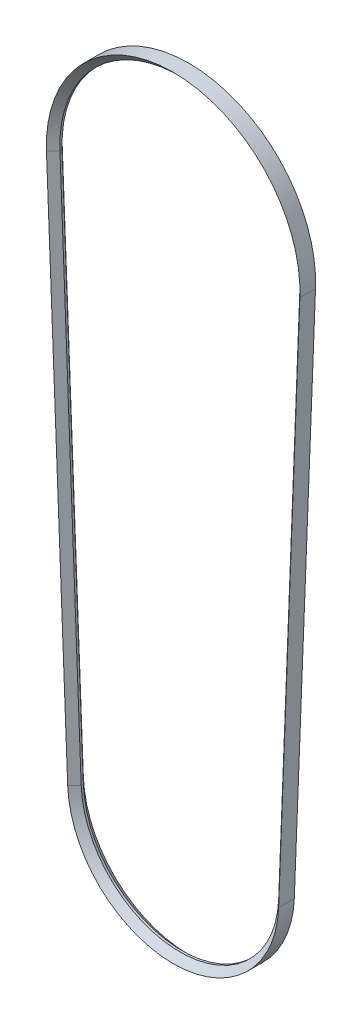
from build123d import *


with BuildPart() as part:
    # Sweep1: sweep along a path in Sketch1
    with BuildLine(Plane.XY) as sweep1_path:
        Line((139.891457706, 629.488188976), (114.910840259, -4.527559055))
        ThreePointArc((114.910840259, -4.527559055), (0, -115), (-114.910840259, -4.527559055))
        Line((-114.910840259, -4.527559055), (-139.891457706, 629.488188976))
        ThreePointArc((-139.891457706, 629.488188976), (0, 775), (139.891457706, 629.488188976))
    # Sketch2 → Sweep1 (sweep)
    with BuildSketch(Plane(origin=(139.891457706, 629.488188976, 0), x_dir=(0.9992246979033264, -0.03937007874015808, 0), z_dir=(-0.03937007874015808, -0.9992246979033264, 0))):
        Polygon((1.26875, 1.26875), (9.20625, 9.20625), (9.20625, -9.20625), (1.26875, -1.26875), align=None)
    sweep(path=sweep1_path.line)


solid = part.part
